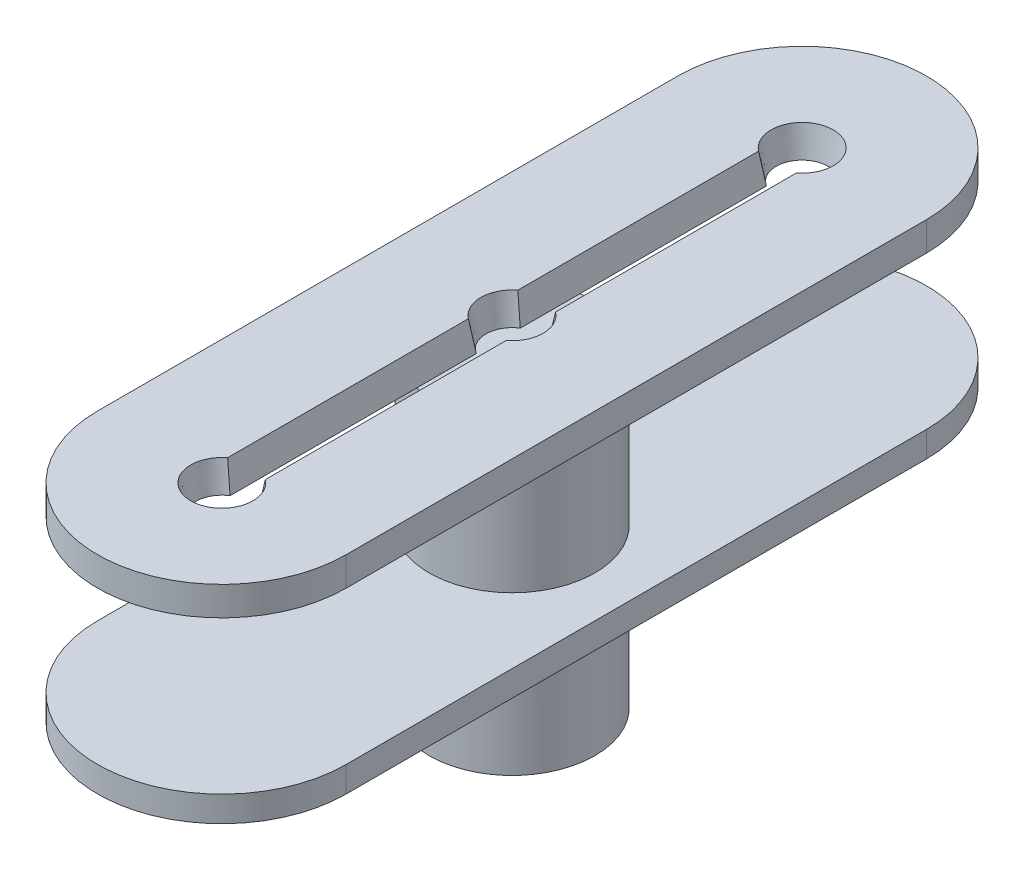
from build123d import *

# Parameters (mm, degrees)
SALIENTE_EXTRUIR1_DEPTH = 5
CORTAR_EXTRUIR1_DEPTH   = 1
CORTAR_EXTRUIR1_DRAFT   = -10
CROQUIS3_W              = 20
CROQUIS3_H              = 3.682271405
CORTAR_EXTRUIR3_DEPTH   = 13.68857754
CROQUIS4_R              = 2
SALIENTE_EXTRUIR2_DEPTH = 7.5


with BuildPart() as part:
    # Croquis1 → Saliente-Extruir1 (new body)
    with BuildSketch(Plane(origin=(0, 0, 0), x_dir=(1, 0, 0), z_dir=(0, 1, 0))):
        with BuildLine():
            Line((-3, -7), (-3, 7))
            ThreePointArc((-3, 7), (0, 10), (3, 7))
            Line((3, 7), (3, -7))
            ThreePointArc((3, -7), (0, -10), (-3, -7))
        make_face()
    extrude(amount=SALIENTE_EXTRUIR1_DEPTH)


with BuildPart() as cortar_extruir1_tool:
    # Croquis2 → Cortar-Extruir1 (with draft: the straight prism first)
    with BuildSketch(Plane(origin=(0, 5, 0), x_dir=(1, 0, 0), z_dir=(0, 1, 0))):
        with BuildLine():
            Line((-0.455587581, 6.404231625), (-0.455587581, 0.595768375))
            ThreePointArc((-0.455587581, 0.595768375), (-0.75, 0), (-0.455587581, -0.595768375))
            Line((-0.455587581, -0.595768375), (-0.455587581, -6.404231625))
            ThreePointArc((-0.455587581, -6.404231625), (0, -7.75), (0.455587581, -6.404231625))
            Line((0.455587581, -6.404231625), (0.455587581, -0.595768375))
            ThreePointArc((0.455587581, -0.595768375), (0.75, 0), (0.455587581, 0.595768375))
            Line((0.455587581, 0.595768375), (0.455587581, 6.404231625))
            ThreePointArc((0.455587581, 6.404231625), (0, 7.75), (-0.455587581, 6.404231625))
        make_face()
    extrude(amount=-CORTAR_EXTRUIR1_DEPTH)
    # Cortar-Extruir1: the draft: its side faces are tilted about the plane it starts from
    cortar_extruir1_sides = [cortar_extruir1_tool.faces().sort_by_distance(p)[0] for p in [
        (0, 4.5, -7.75),
        (-0.455587581, 4.5, -3.5),
        (-0.75, 4.5, 0),
        (-0.455587581, 4.5, 3.5),
        (0, 4.5, 7.75),
        (0.455587581, 4.5, 3.5),
        (0.75, 4.5, 0),
        (0.455587581, 4.5, -3.5),
    ]]
    draft(cortar_extruir1_sides, Plane(origin=(0, 5, 0), x_dir=(1, 0, 0), z_dir=(0, 1, 0)), CORTAR_EXTRUIR1_DRAFT)


with BuildPart() as part_1:
    add(part.part)

    # Cortar-Extruir1: cut by cortar_extruir1_tool
    add(cortar_extruir1_tool.part, mode=Mode.SUBTRACT)

    # Croquis3 → Cortar-Extruir3 (cut, through all)
    with BuildSketch(Plane(origin=(3, 0, 0), x_dir=(0, 0, -1), z_dir=(1, 0, 0))):
        with Locations((0, 2.458864298)):
            Rectangle(CROQUIS3_W, CROQUIS3_H)
    extrude(amount=-CORTAR_EXTRUIR3_DEPTH, mode=Mode.SUBTRACT)


with BuildPart() as cortar_extruir3_piece_1:
    # of the separate pieces the step leaves, piece 1, a body of its own (cortar_extruir3_pieces)
    add(part_1.part.solids().sort_by_distance((-3, 0, 7))[0])



with BuildPart() as cortar_extruir3_piece_2:
    # of the separate pieces the step leaves, piece 2, a body of its own (cortar_extruir3_pieces)
    add(part_1.part.solids().sort_by_distance((-3, 4.3, -7))[0])


with BuildPart() as cortar_extruir3_piece_1_1:
    add(cortar_extruir3_piece_1.part)

    add(cortar_extruir3_piece_2.part)  # Saliente-Extruir2 merges Cortar-Extruir3 piece 2
    # Croquis4 → Saliente-Extruir2 (add)
    with BuildSketch(Plane.XZ.offset(-4.3)):
        with Locations(Location((0, 0, 0), (0, 0, 80.440058332))):
            Circle(CROQUIS4_R)
    extrude(amount=SALIENTE_EXTRUIR2_DEPTH)


solid = cortar_extruir3_piece_1_1.part
